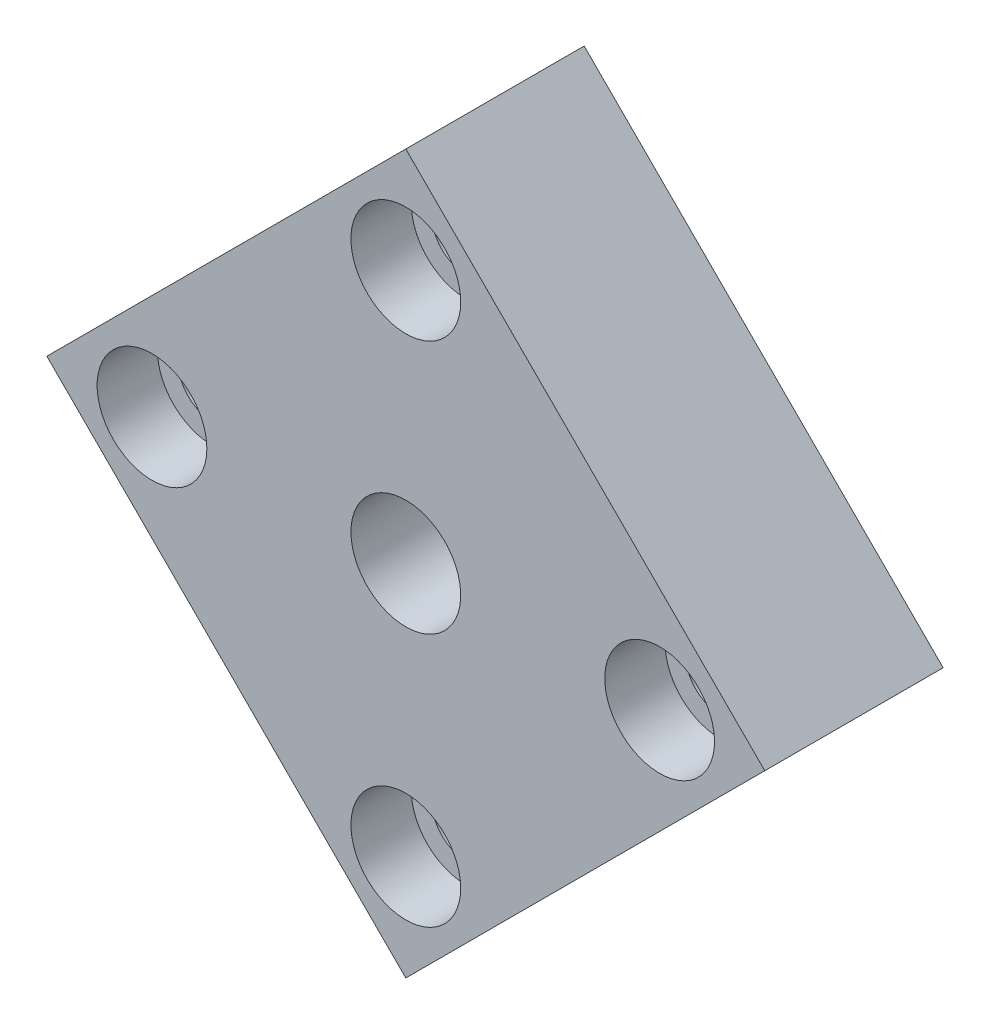
from build123d import *

# Parameters (mm, degrees)
SKETCH_1_R          = 2.5
SKETCH_1_R_2        = 4
EXTRUDE_1_DEPTH     = 13
SKETCH_2_R          = 4
CUT_EXTRUDE_1_DEPTH = 4.4


with BuildPart() as part:
    # 草图1 → 凸台-拉伸1 (new body)
    with BuildSketch(Plane.XY):
        Polygon((0, 26.162950904), (-26.162950904, 0), (0, -26.162950904), (26.162950904, 0), align=None)
        with Locations(Location((18.5, 0, 0), (0, 0, 180))):
            Circle(SKETCH_1_R, mode=Mode.SUBTRACT)
        with Locations(Location((0, -18.5, 0), (0, 0, 180))):
            Circle(SKETCH_1_R, mode=Mode.SUBTRACT)
        with Locations(Location((-18.5, 0, 0), (0, 0, 180))):
            Circle(SKETCH_1_R, mode=Mode.SUBTRACT)
        with Locations(Location((0, 18.5, 0), (0, 0, 180))):
            Circle(SKETCH_1_R, mode=Mode.SUBTRACT)
        with Locations(Location((0, 0, 0), (0, 0, 180))):
            Circle(SKETCH_1_R_2, mode=Mode.SUBTRACT)
    extrude(amount=EXTRUDE_1_DEPTH)

    # 草图2 → 切除-拉伸1 (cut)
    with BuildSketch(Plane.XY.offset(13)):
        with Locations((18.5, 0)):
            Circle(SKETCH_2_R)
        with Locations((0, -18.5)):
            Circle(SKETCH_2_R)
        with Locations((-18.5, 0)):
            Circle(SKETCH_2_R)
        with Locations((0, 18.5)):
            Circle(SKETCH_2_R)
    extrude(amount=-CUT_EXTRUDE_1_DEPTH, mode=Mode.SUBTRACT)


solid = part.part
